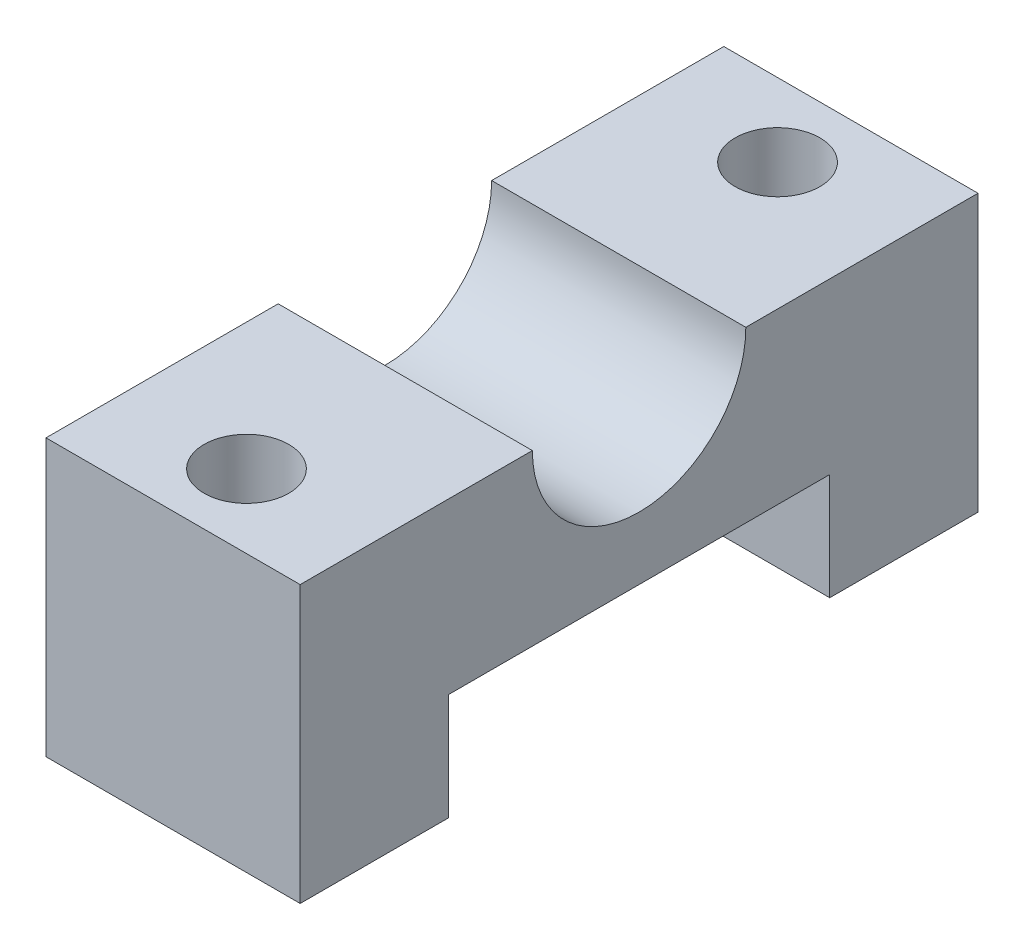
from build123d import *

# Parameters (mm, degrees)
BOSS_EXTRUDE1_DEPTH = 9.525
SKETCH3_W           = 14.2875
SKETCH3_H           = 4
CUT_EXTRUDE1_DEPTH  = 19.95093995
SKETCH4_R           = 1.5875
CUT_EXTRUDE2_DEPTH  = 19.95093995


with BuildPart() as part:
    # Sketch1 → Boss-Extrude1 (new body)
    with BuildSketch(Plane(origin=(0, 0, 0), x_dir=(0, 0, -1), z_dir=(1, 0, 0))):
        with BuildLine():
            Line((4, 0), (12.7, 0))
            Line((12.7, 0), (12.7, -10.35))
            Line((12.7, -10.35), (-12.7, -10.35))
            Line((-12.7, -10.35), (-12.7, 0))
            Line((-12.7, 0), (-4, 0))
            ThreePointArc((-4, 0), (0, -4), (4, 0))
        make_face()
    extrude(amount=BOSS_EXTRUDE1_DEPTH)

    # Sketch3 → Cut-Extrude1 (cut, through all)
    with BuildSketch(Plane(origin=(9.525, 0, 0), x_dir=(0, 0, -1), z_dir=(1, 0, 0))):
        with Locations((0, -8.35)):
            Rectangle(SKETCH3_W, SKETCH3_H)
    extrude(amount=-CUT_EXTRUDE1_DEPTH, mode=Mode.SUBTRACT)

    # Sketch4 → Cut-Extrude2 (cut, through all)
    with BuildSketch(Plane.XZ.offset(10.35)):
        with Locations(Location((4.7625, -9.95, 0), (0, 0, 270))):
            Circle(SKETCH4_R)
        with Locations(Location((4.7625, 9.95, 0), (0, 0, 270))):
            Circle(SKETCH4_R)
    extrude(amount=-CUT_EXTRUDE2_DEPTH, mode=Mode.SUBTRACT)


solid = part.part
